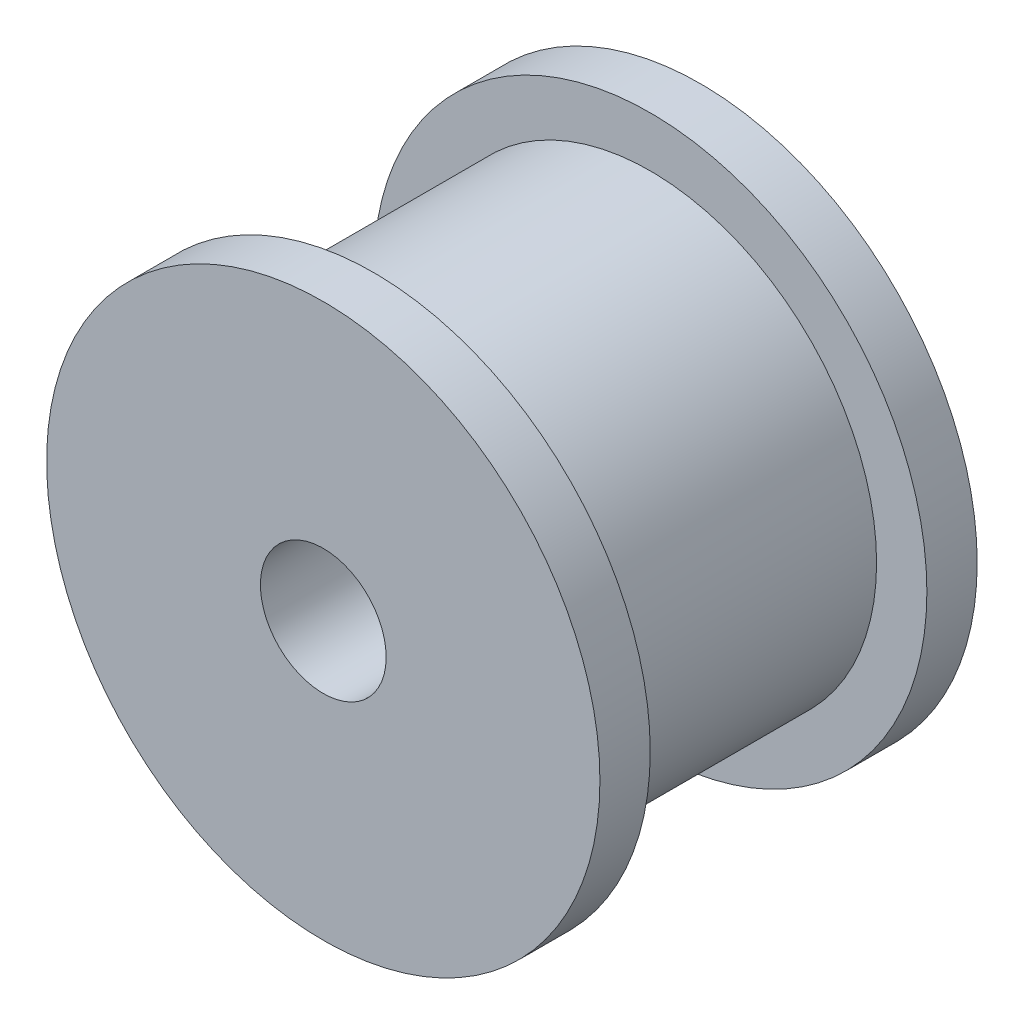
from build123d import *

# Parameters (mm, degrees)
SKETCH_1_R      = 11
SKETCH_1_R_2    = 2.5
EXTRUDE_1_DEPTH = 2
SKETCH_2_R      = 9
SKETCH_2_R_2    = 2.5
EXTRUDE_2_DEPTH = 11
SKETCH_3_R      = 11
SKETCH_3_R_2    = 2.5
EXTRUDE_3_DEPTH = 2


with BuildPart() as part:
    # 草图1 → 凸台-拉伸1 (new body)
    with BuildSketch(Plane.XY):
        Circle(SKETCH_1_R)
        Circle(SKETCH_1_R_2, mode=Mode.SUBTRACT)
    extrude(amount=EXTRUDE_1_DEPTH)

    # 草图2 → 凸台-拉伸2 (add)
    with BuildSketch(Plane.XY.offset(2)):
        Circle(SKETCH_2_R)
        Circle(SKETCH_2_R_2, mode=Mode.SUBTRACT)
    extrude(amount=EXTRUDE_2_DEPTH)

    # 草图3 → 凸台-拉伸3 (add)
    with BuildSketch(Plane.XY.offset(13)):
        Circle(SKETCH_3_R)
        Circle(SKETCH_3_R_2, mode=Mode.SUBTRACT)
    extrude(amount=EXTRUDE_3_DEPTH)


solid = part.part
